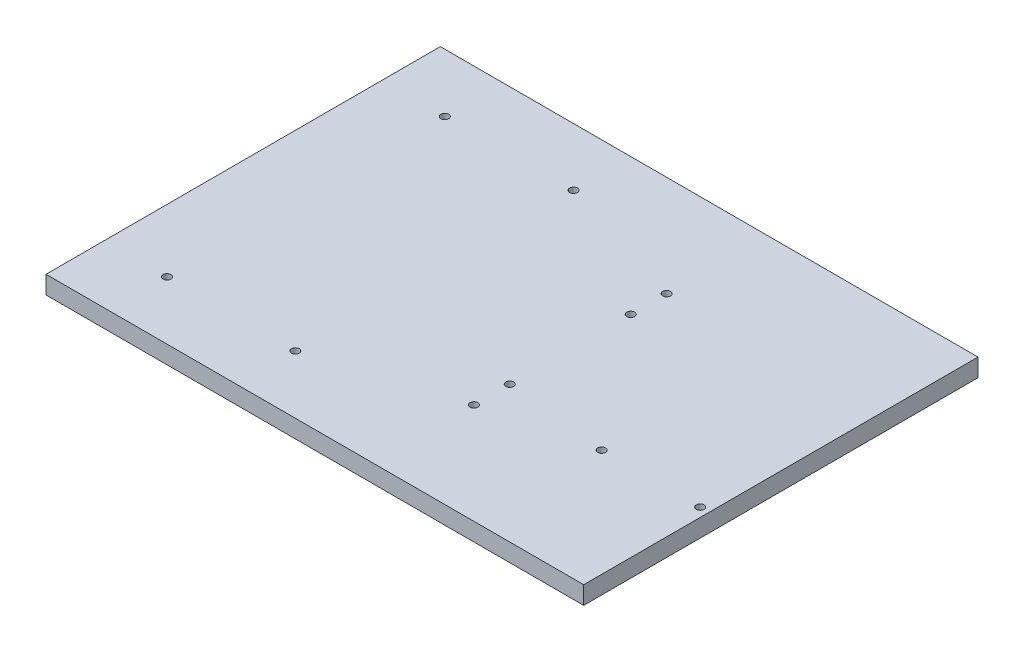
from build123d import *

# Parameters (mm, degrees)
SKETCH1_W           = 304.8
SKETCH1_H           = 304.8
BOSS_EXTRUDE1_DEPTH = 6.35
CUT_EXTRUDE1_DEPTH  = 432.099063441
SKETCH3_R           = 1.3890625
CUT_EXTRUDE2_DEPTH  = 360.49076831
SKETCH4_R           = 1.3890625
CUT_EXTRUDE3_DEPTH  = 360.49076831
SKETCH5_R           = 1.3890625
CUT_EXTRUDE4_DEPTH  = 360.49076831


with BuildPart() as part:
    # Sketch1 → Boss-Extrude1 (new body)
    with BuildSketch(Plane(origin=(0, 0, 0), x_dir=(1, 0, 0), z_dir=(0, 1, 0))):
        with Locations((152.4, 152.4)):
            Rectangle(SKETCH1_W, SKETCH1_H)
    extrude(amount=BOSS_EXTRUDE1_DEPTH)

    # Sketch2 → Cut-Extrude1 (cut, through all)
    with BuildSketch(Plane(origin=(0, 6.35, 0), x_dir=(1, 0, 0), z_dir=(0, 1, 0))):
        Polygon((190.5, 304.8), (190.5, 165.1), (0, 165.1), (0, 0), (304.8, 0), (304.8, 304.8), align=None)
    extrude(amount=-CUT_EXTRUDE1_DEPTH, mode=Mode.SUBTRACT)

    # Sketch3 → Cut-Extrude2 (cut, through all)
    with BuildSketch(Plane(origin=(0, 6.35, 0), x_dir=(1, 0, 0), z_dir=(0, 1, 0))):
        with Locations(Location((22.225, 185.7375, 0), (0, 0, 270))):
            Circle(SKETCH3_R)
        with Locations(Location((67.691, 185.7375, 0), (0, 0, 270))):
            Circle(SKETCH3_R)
        with Locations(Location((22.225, 284.1625, 0), (0, 0, 270))):
            Circle(SKETCH3_R)
        with Locations(Location((67.691, 284.320434064, 0), (0, 0, 270))):
            Circle(SKETCH3_R)
    extrude(amount=-CUT_EXTRUDE2_DEPTH, mode=Mode.SUBTRACT)

    # Sketch4 → Cut-Extrude3 (cut, through all)
    with BuildSketch(Plane(origin=(0, 6.35, 0), x_dir=(1, 0, 0), z_dir=(0, 1, 0))):
        with Locations(Location((115.8875, 269.08125, 0), (0, 0, 270))):
            Circle(SKETCH4_R)
        with Locations(Location((115.8875, 256.38125, 0), (0, 0, 270))):
            Circle(SKETCH4_R)
        with Locations(Location((115.8875, 200.81875, 0), (0, 0, 270))):
            Circle(SKETCH4_R)
        with Locations(Location((115.8875, 213.51875, 0), (0, 0, 270))):
            Circle(SKETCH4_R)
    extrude(amount=-CUT_EXTRUDE3_DEPTH, mode=Mode.SUBTRACT)

    # Sketch5 → Cut-Extrude4 (cut, through all)
    with BuildSketch(Plane(origin=(0, 6.35, 0), x_dir=(1, 0, 0), z_dir=(0, 1, 0))):
        with Locations(Location((187.325, 209.55, 0), (0, 0, 270))):
            Circle(SKETCH5_R)
        with Locations(Location((152.4, 209.55, 0), (0, 0, 270))):
            Circle(SKETCH5_R)
    extrude(amount=-CUT_EXTRUDE4_DEPTH, mode=Mode.SUBTRACT)


solid = part.part
